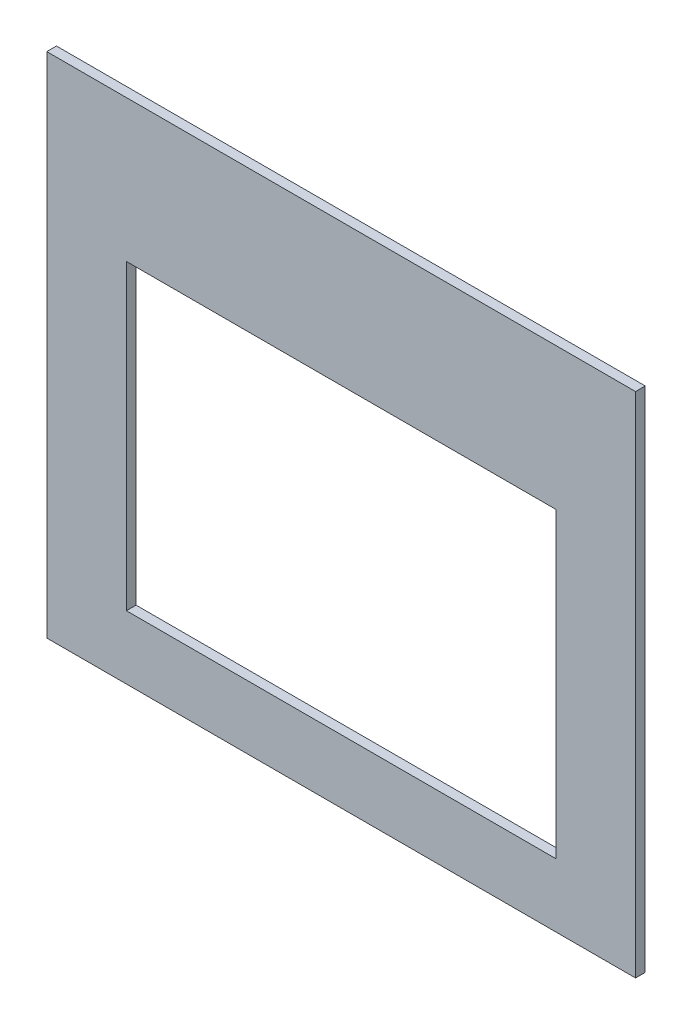
from build123d import *

# Parameters (mm, degrees)
SKETCH1_W           = 1094.236516538
SKETCH1_H           = 943.901471863
BOSS_EXTRUDE1_DEPTH = 18
SKETCH2_W           = 798.236516538
SKETCH2_H           = 562.151471863
CUT_EXTRUDE1_DEPTH  = 18


with BuildPart() as part:
    # Sketch1 → Boss-Extrude1 (new body)
    with BuildSketch(Plane.XY):
        with Locations((414.118258269, 453.950735932)):
            Rectangle(SKETCH1_W, SKETCH1_H)
    extrude(amount=BOSS_EXTRUDE1_DEPTH)

    # Sketch2 → Cut-Extrude1 (cut)
    with BuildSketch(Plane.XY.offset(18)):
        with Locations((414.118258269, 381.075735932)):
            Rectangle(SKETCH2_W, SKETCH2_H)
    extrude(amount=-CUT_EXTRUDE1_DEPTH, mode=Mode.SUBTRACT)


solid = part.part
